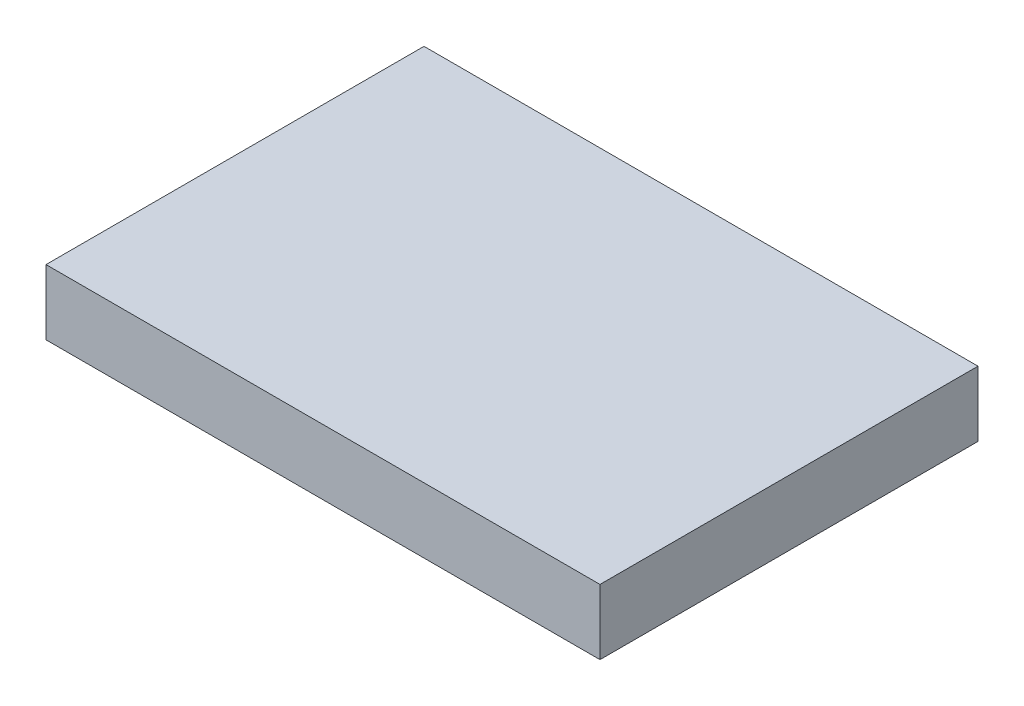
from build123d import *

# Parameters (mm, degrees)
SKETCH_1_W      = 85
SKETCH_1_H      = 58
EXTRUDE_1_DEPTH = 10


with BuildPart() as part:
    # 草图1 → 凸台-拉伸1 (new body)
    with BuildSketch(Plane(origin=(0, 0, 0), x_dir=(1, 0, 0), z_dir=(0, 1, 0))):
        with Locations((5.01552795, -13.601449275)):
            Rectangle(SKETCH_1_W, SKETCH_1_H)
    extrude(amount=EXTRUDE_1_DEPTH)


solid = part.part
